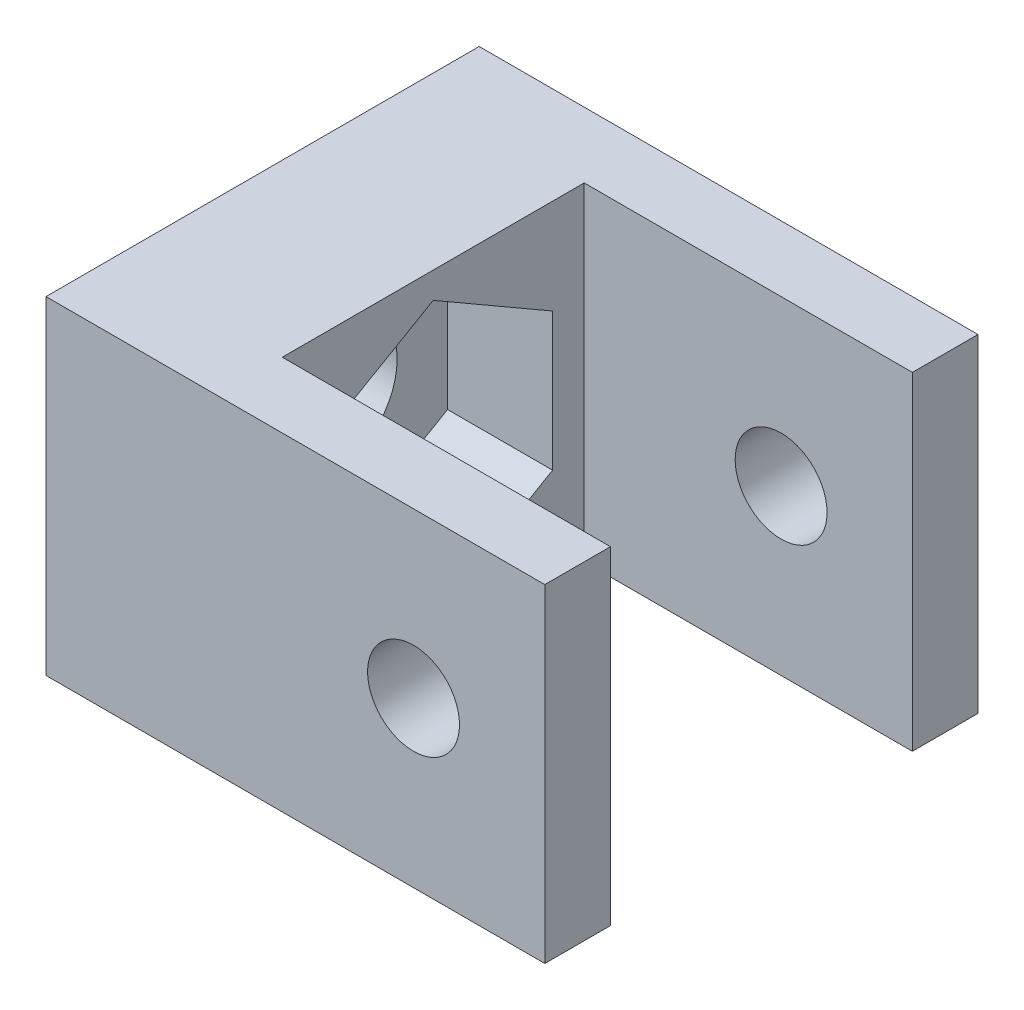
from build123d import *

# Parameters (mm, degrees)
BOSS_EXTRU_1_DEPTH      = 25
ESQUISSE3_R             = 3.5
ENL_V_MAT_EXTRU_1_DEPTH = 57.196085273
ESQUISSE4_R             = 5.25
ENL_V_MAT_EXTRU_2_DEPTH = 49.363209157
ENL_V_MAT_EXTRU_3_DEPTH = 8


with BuildPart() as part:
    # Esquisse2 → Boss.-Extru.1 (new body)
    with BuildSketch(Plane(origin=(0, 0, 0), x_dir=(1, 0, 0), z_dir=(0, 1, 0))):
        Polygon((0, 0), (-38, 0), (-38, -33), (0, -33), (0, -28), (-25, -28), (-25, -5), (0, -5), align=None)
    extrude(amount=BOSS_EXTRU_1_DEPTH)

    # Esquisse3 → Enlèv. mat.-Extru.1 (cut, through all)
    with BuildSketch(Plane.XY.offset(33)):
        with Locations((-10, 12.5)):
            Circle(ESQUISSE3_R)
    extrude(amount=-ENL_V_MAT_EXTRU_1_DEPTH, mode=Mode.SUBTRACT)

    # Esquisse4 → Enlèv. mat.-Extru.2 (cut, through all)
    with BuildSketch(Plane(origin=(-25, 0, 0), x_dir=(0, 0, -1), z_dir=(1, 0, 0))):
        with Locations((-16.5, 12.5)):
            Circle(ESQUISSE4_R)
    extrude(amount=-ENL_V_MAT_EXTRU_2_DEPTH, mode=Mode.SUBTRACT)

    # Esquisse5 → Enlèv. mat.-Extru.3 (cut)
    with BuildSketch(Plane(origin=(-25, 0, 0), x_dir=(0, 0, -1), z_dir=(1, 0, 0))):
        Polygon((-7.40673326, 17.75), (-16.5, 23), (-25.59326674, 17.75), (-25.59326674, 7.25), (-16.5, 2), (-7.40673326, 7.25), align=None)
    extrude(amount=-ENL_V_MAT_EXTRU_3_DEPTH, mode=Mode.SUBTRACT)


solid = part.part
